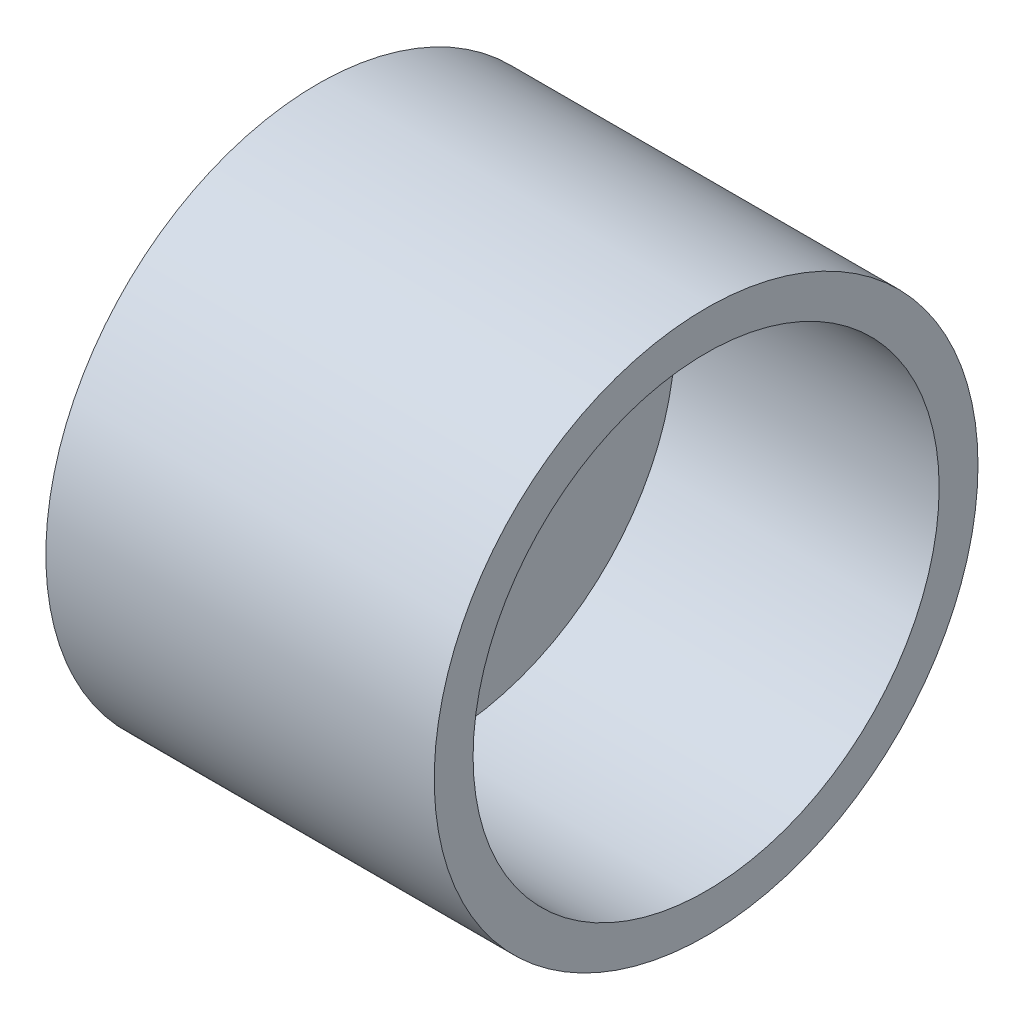
from build123d import *

# Parameters (mm, degrees)
SKETCH1_R           = 17.5
SKETCH1_R_2         = 15
BOSS_EXTRUDE1_DEPTH = 25
SKETCH1_3_R         = 15
SKETCH1_3_R_2       = 1.5
BOSS_EXTRUDE2_DEPTH = 8


with BuildPart() as part:
    # Sketch1 → Boss-Extrude1 (new body)
    with BuildSketch(Plane(origin=(0, 0, 0), x_dir=(0, 0, -1), z_dir=(1, 0, 0))):
        Circle(SKETCH1_R)
        Circle(SKETCH1_R_2, mode=Mode.SUBTRACT)
    extrude(amount=BOSS_EXTRUDE1_DEPTH)

    # Sketch1<3> → Boss-Extrude2 (add)
    with BuildSketch(Plane(origin=(0, 0, 0), x_dir=(0, 0, -1), z_dir=(1, 0, 0))):
        Circle(SKETCH1_3_R)
        Circle(SKETCH1_3_R_2, mode=Mode.SUBTRACT)
    extrude(amount=BOSS_EXTRUDE2_DEPTH)


solid = part.part
